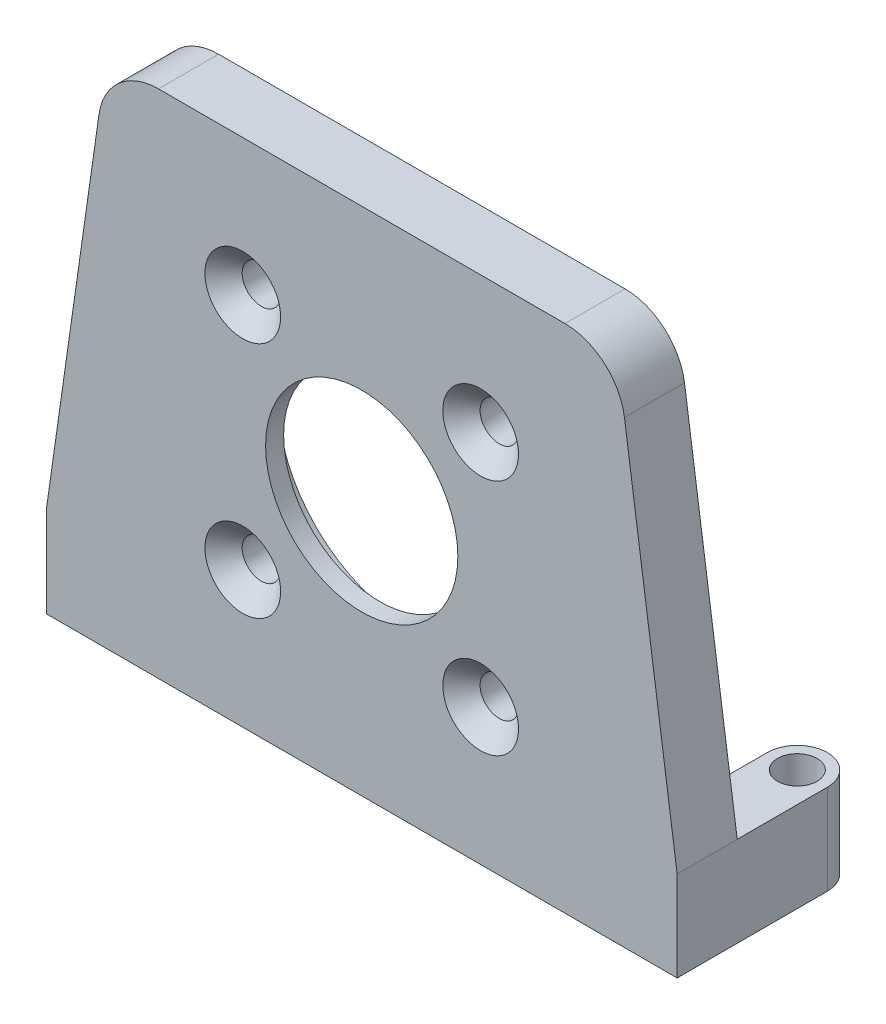
from build123d import *

# Parameters (mm, degrees)
SKIZZE1_R                                            = 8
AUFSATZ_LINEAR_AUSTRAGEN1_DEPTH                      = 5
AUFSATZ_LINEAR_AUSTRAGEN2_DEPTH                      = 7.5
FORMSENKUNG_F_R_M3_SENKSCHRAUBE_MIT_SCHL_D           = 3.2
FORMSENKUNG_F_R_M3_SENKSCHRAUBE_MIT_SCHL_CSINK_D     = 6.3
FORMSENKUNG_F_R_M3_SENKSCHRAUBE_MIT_SCHL_CSINK_ANGLE = 90
M4_GEWINDEBOHRUNG2_D                                 = 3.3
M4_GEWINDEBOHRUNG2_DEPTH                             = 13
M4_GEWINDEBOHRUNG2_TIP                               = 0.991420021
SKIZZE15_R                                           = 18.25
SCHNITT_LINEAR_AUSTRAGEN1_DEPTH                      = 1
SKIZZE16_R                                           = 11.0125
SCHNITT_LINEAR_AUSTRAGEN2_DEPTH                      = 2.5


with BuildPart() as part:
    # Skizze1 → Aufsatz-Linear austragen1 (new body)
    with BuildSketch(Plane.XY):
        with BuildLine():
            Line((0, 0), (52.5, 0))
            Line((52.5, 0), (52.5, 7.5))
            Line((52.5, 7.5), (48.11327046, 38.207106781))
            ThreePointArc((48.11327046, 38.207106781), (46.439531698, 41.277269775), (43.163522992, 42.5))
            Line((43.163522992, 42.5), (9.336477008, 42.5))
            ThreePointArc((9.336477008, 42.5), (6.060468302, 41.277269775), (4.38672954, 38.207106781))
            Line((4.38672954, 38.207106781), (0, 7.5))
            Line((0, 7.5), (0, 0))
        make_face()
        with Locations((26.25, 21.25)):
            Circle(SKIZZE1_R, mode=Mode.SUBTRACT)
    extrude(amount=AUFSATZ_LINEAR_AUSTRAGEN1_DEPTH)

    # Skizze4 → Aufsatz-Linear austragen2 (add)
    with BuildSketch(Plane.XZ):
        with BuildLine():
            Line((52.5, 0), (47.5, 0))
            Line((47.5, 0), (47.5, -7.5))
            ThreePointArc((47.5, -7.5), (50, -10), (52.5, -7.5))
            Line((52.5, -7.5), (52.5, 0))
        make_face()
        with BuildLine():
            Line((0, 0), (5, 0))
            Line((5, 0), (5, -7.5))
            ThreePointArc((5, -7.5), (2.5, -10), (0, -7.5))
            Line((0, -7.5), (0, 0))
        make_face()
    extrude(amount=-AUFSATZ_LINEAR_AUSTRAGEN2_DEPTH)

    # Formsenkung für M3 Senkschraube mit Schlitz/Kreuzschlitz1 (through all)
    with Locations(Plane.XY.offset(5)):
        with Locations((16.350505063, 31.149494937), (36.149494937, 11.350505063), (16.350505063, 11.350505063), (36.149494937, 31.149494937)):
            CounterSinkHole(FORMSENKUNG_F_R_M3_SENKSCHRAUBE_MIT_SCHL_D / 2, FORMSENKUNG_F_R_M3_SENKSCHRAUBE_MIT_SCHL_CSINK_D / 2, counter_sink_angle=FORMSENKUNG_F_R_M3_SENKSCHRAUBE_MIT_SCHL_CSINK_ANGLE)

    # M4 Gewindebohrung2
    with Locations(Plane(origin=(0, 0, 0), x_dir=(-1, 0, 0), z_dir=(0, -1, 0))):
        with Locations((-2.5, 7.5), (-50, 7.5), (-50, -2.5), (-2.5, -2.5)):
            Hole(M4_GEWINDEBOHRUNG2_D / 2, depth=M4_GEWINDEBOHRUNG2_DEPTH)
            with Locations((0, 0, -(M4_GEWINDEBOHRUNG2_DEPTH + M4_GEWINDEBOHRUNG2_TIP / 2))):  # 118° drill point
                Cone(0, M4_GEWINDEBOHRUNG2_D / 2, M4_GEWINDEBOHRUNG2_TIP, mode=Mode.SUBTRACT)

    # Skizze15 → Schnitt-Linear austragen1 (cut)
    with BuildSketch(Plane(origin=(0, 0, 0), x_dir=(-1, 0, 0), z_dir=(0, 0, -1))):
        with Locations((-26.25, 21.25)):
            Circle(SKIZZE15_R)
    extrude(amount=-SCHNITT_LINEAR_AUSTRAGEN1_DEPTH, mode=Mode.SUBTRACT)

    # Skizze16 → Schnitt-Linear austragen2 (cut)
    with BuildSketch(Plane(origin=(0, 0, 1), x_dir=(-1, 0, 0), z_dir=(0, 0, -1))):
        with Locations((-26.25, 21.25)):
            Circle(SKIZZE16_R)
    extrude(amount=-SCHNITT_LINEAR_AUSTRAGEN2_DEPTH, mode=Mode.SUBTRACT)


solid = part.part
